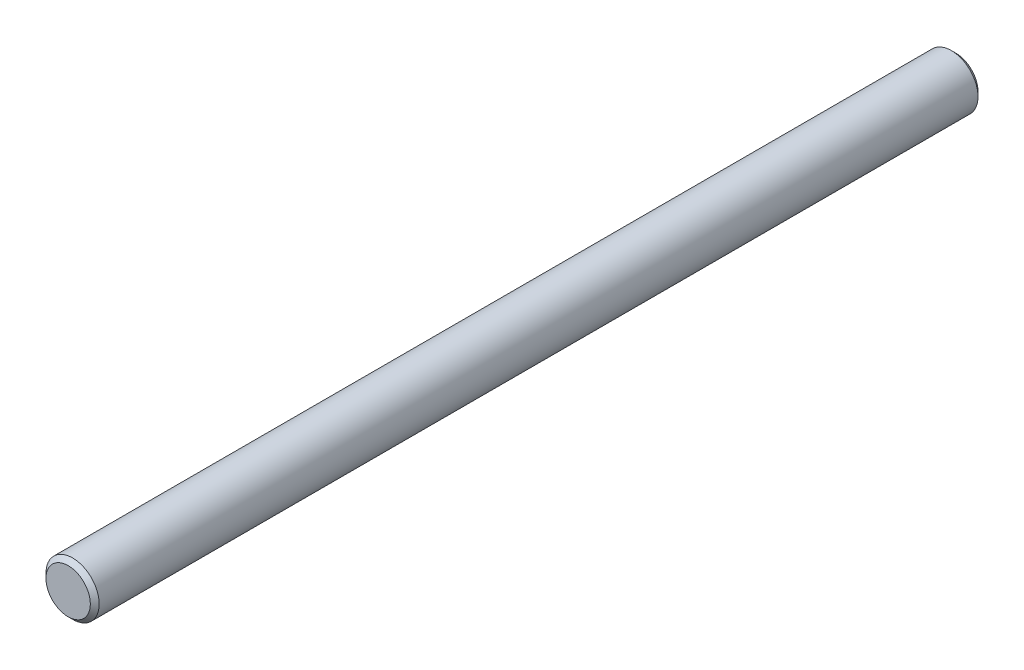
from build123d import *

# Parameters (mm, degrees)
SKETCH1_R           = 3
BOSS_EXTRUDE1_DEPTH = 100
CHAMFER1_SIZE       = 0.5


with BuildPart() as part:
    # Sketch1 → Boss-Extrude1 (new body)
    with BuildSketch(Plane.XY):
        Circle(SKETCH1_R)
    extrude(amount=BOSS_EXTRUDE1_DEPTH)

    # Chamfer1
    chamfer1_edges = [part.edges().sort_by_distance(p)[0] for p in [
        (-3, 0, 0),
        (-3, 0, 100),
    ]]
    chamfer(chamfer1_edges, length=CHAMFER1_SIZE)


solid = part.part
